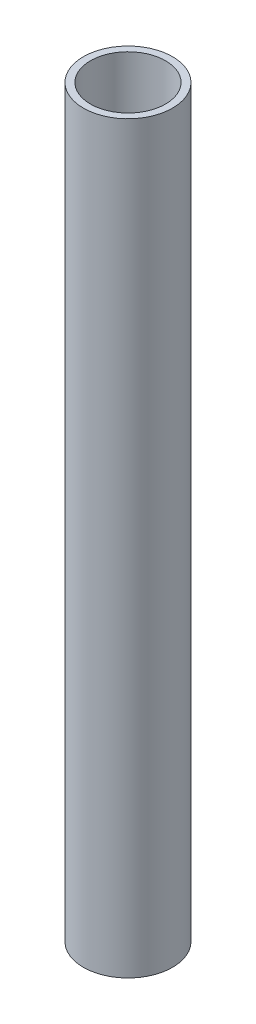
from build123d import *

# Parameters (mm, degrees)
SKETCH1_R           = 6.35
SKETCH1_R_2         = 5.35
BOSS_EXTRUDE1_DEPTH = 106


with BuildPart() as part:
    # Sketch1 → Boss-Extrude1 (new body)
    with BuildSketch(Plane(origin=(0, 0, 0), x_dir=(1, 0, 0), z_dir=(0, 1, 0))):
        with Locations(Location((0, 0, 0), (0, 0, 270))):
            Circle(SKETCH1_R)
        with Locations(Location((0, 0, 0), (0, 0, 270))):
            Circle(SKETCH1_R_2, mode=Mode.SUBTRACT)
    extrude(amount=BOSS_EXTRUDE1_DEPTH)


solid = part.part
